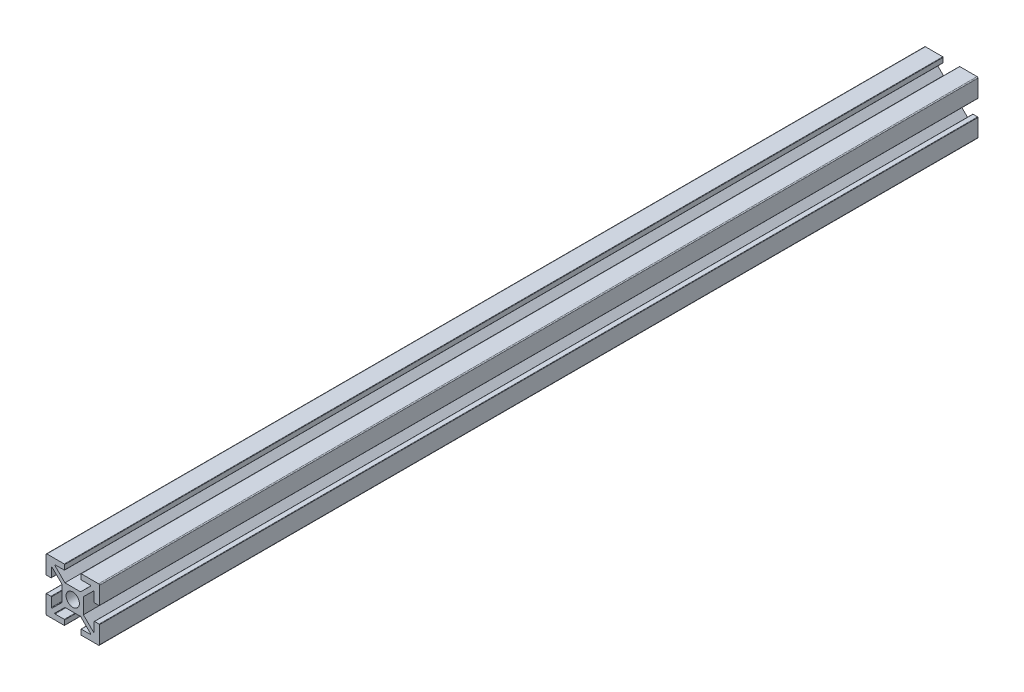
from build123d import *

# Parameters (mm, degrees)
SKETCH1_R           = 2.5
BOSS_EXTRUDE1_DEPTH = 330


with BuildPart() as part:
    # Sketch1 → Boss-Extrude1 (new body)
    with BuildSketch(Plane.XY):
        with BuildLine():
            Line((-7.427382464, 2.155691805), (-5.727382464, 2.155691805))
            ThreePointArc((-5.727382464, 2.155691805), (-5.621316447, 2.199625788), (-5.577382464, 2.305691805))
            Line((-5.577382464, 2.305691805), (-5.577382464, 5.741876319))
            ThreePointArc((-5.577382464, 5.741876319), (-5.485183419, 5.880292537), (-5.321928469, 5.848550846))
            Line((-5.321928469, 5.848550846), (-1.531086168, 2.101082027))
            Line((-1.531086168, 2.101082027), (-1.531086168, -3.789698417))
            Line((-1.531086168, -3.789698417), (-5.321928469, -7.537167236))
            ThreePointArc((-5.321928469, -7.537167236), (-5.485183419, -7.568908927), (-5.577382464, -7.430492708))
            Line((-5.577382464, -7.430492708), (-5.577382464, -3.994308195))
            ThreePointArc((-5.577382464, -3.994308195), (-5.621316447, -3.888242178), (-5.727382464, -3.844308195))
            Line((-5.727382464, -3.844308195), (-7.427382464, -3.844308195))
            ThreePointArc((-7.427382464, -3.844308195), (-7.533448481, -3.888242178), (-7.577382464, -3.994308195))
            Line((-7.577382464, -3.994308195), (-7.577382464, -10.494308195))
            ThreePointArc((-7.577382464, -10.494308195), (-7.474869837, -10.741795568), (-7.227382464, -10.844308195))
            Line((-7.227382464, -10.844308195), (-0.727382464, -10.844308195))
            ThreePointArc((-0.727382464, -10.844308195), (-0.621316447, -10.800374212), (-0.577382464, -10.694308195))
            Line((-0.577382464, -10.694308195), (-0.577382464, -8.994308195))
            ThreePointArc((-0.577382464, -8.994308195), (-0.621316447, -8.888242178), (-0.727382464, -8.844308195))
            Line((-0.727382464, -8.844308195), (-4.145467261, -8.844308195))
            ThreePointArc((-4.145467261, -8.844308195), (-4.284213755, -8.751311795), (-4.250921257, -8.587633667))
            Line((-4.250921257, -8.587633667), (-0.464270258, -4.844308195))
            Line((-0.464270258, -4.844308195), (5.402097922, -4.844308195))
            Line((5.402097922, -4.844308195), (9.188748921, -8.587633667))
            ThreePointArc((9.188748921, -8.587633667), (9.22204142, -8.751311795), (9.083294926, -8.844308195))
            Line((9.083294926, -8.844308195), (5.665210129, -8.844308195))
            ThreePointArc((5.665210129, -8.844308195), (5.559144111, -8.888242178), (5.515210129, -8.994308195))
            Line((5.515210129, -8.994308195), (5.515210129, -10.694308195))
            ThreePointArc((5.515210129, -10.694308195), (5.559144111, -10.800374212), (5.665210129, -10.844308195))
            Line((5.665210129, -10.844308195), (12.165210129, -10.844308195))
            ThreePointArc((12.165210129, -10.844308195), (12.412697502, -10.741795568), (12.515210129, -10.494308195))
            Line((12.515210129, -10.494308195), (12.515210129, -3.994308195))
            ThreePointArc((12.515210129, -3.994308195), (12.471276146, -3.888242178), (12.365210129, -3.844308195))
            Line((12.365210129, -3.844308195), (10.665210129, -3.844308195))
            ThreePointArc((10.665210129, -3.844308195), (10.559144111, -3.888242178), (10.515210129, -3.994308195))
            Line((10.515210129, -3.994308195), (10.515210129, -7.430492708))
            ThreePointArc((10.515210129, -7.430492708), (10.423011083, -7.568908927), (10.259756133, -7.537167236))
            Line((10.259756133, -7.537167236), (6.468913832, -3.789698417))
            Line((6.468913832, -3.789698417), (6.468913832, 2.101082027))
            Line((6.468913832, 2.101082027), (10.259756133, 5.848550846))
            ThreePointArc((10.259756133, 5.848550846), (10.423011083, 5.880292537), (10.515210129, 5.741876319))
            Line((10.515210129, 5.741876319), (10.515210129, 2.305691805))
            ThreePointArc((10.515210129, 2.305691805), (10.559144111, 2.199625788), (10.665210129, 2.155691805))
            Line((10.665210129, 2.155691805), (12.365210129, 2.155691805))
            ThreePointArc((12.365210129, 2.155691805), (12.471276146, 2.199625788), (12.515210129, 2.305691805))
            Line((12.515210129, 2.305691805), (12.515210129, 8.805691805))
            ThreePointArc((12.515210129, 8.805691805), (12.412697502, 9.053179179), (12.165210129, 9.155691805))
            Line((12.165210129, 9.155691805), (5.665210129, 9.155691805))
            ThreePointArc((5.665210129, 9.155691805), (5.559144111, 9.111757822), (5.515210129, 9.005691805))
            Line((5.515210129, 9.005691805), (5.515210129, 7.305691805))
            ThreePointArc((5.515210129, 7.305691805), (5.559144111, 7.199625788), (5.665210129, 7.155691805))
            Line((5.665210129, 7.155691805), (9.083294926, 7.155691805))
            ThreePointArc((9.083294926, 7.155691805), (9.22204142, 7.062695405), (9.188748921, 6.899017277))
            Line((9.188748921, 6.899017277), (5.402097922, 3.155691805))
            Line((5.402097922, 3.155691805), (-0.464270258, 3.155691805))
            Line((-0.464270258, 3.155691805), (-4.250921257, 6.899017277))
            ThreePointArc((-4.250921257, 6.899017277), (-4.284213755, 7.062695405), (-4.145467261, 7.155691805))
            Line((-4.145467261, 7.155691805), (-0.727382464, 7.155691805))
            ThreePointArc((-0.727382464, 7.155691805), (-0.621316447, 7.199625788), (-0.577382464, 7.305691805))
            Line((-0.577382464, 7.305691805), (-0.577382464, 9.005691805))
            ThreePointArc((-0.577382464, 9.005691805), (-0.621316447, 9.111757822), (-0.727382464, 9.155691805))
            Line((-0.727382464, 9.155691805), (-7.227382464, 9.155691805))
            ThreePointArc((-7.227382464, 9.155691805), (-7.474869837, 9.053179179), (-7.577382464, 8.805691805))
            Line((-7.577382464, 8.805691805), (-7.577382464, 2.305691805))
            ThreePointArc((-7.577382464, 2.305691805), (-7.533448481, 2.199625788), (-7.427382464, 2.155691805))
        make_face()
        with Locations((2.468913832, -0.844308195)):
            Circle(SKETCH1_R, mode=Mode.SUBTRACT)
    extrude(amount=BOSS_EXTRUDE1_DEPTH)


solid = part.part
